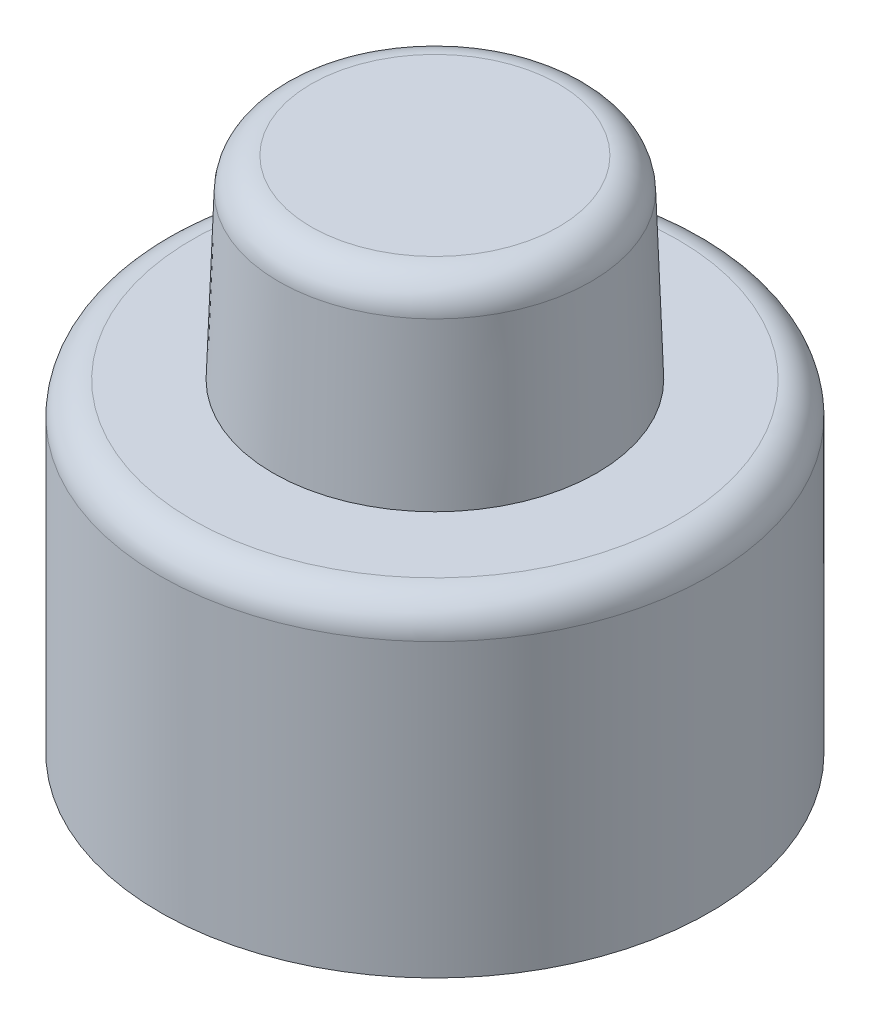
from build123d import *

# Parameters (mm, degrees)
SKETCH1_R           = 8.5
BOSS_EXTRUDE1_DEPTH = 6
FILLET2_R           = 1
SKETCH2_R           = 5
BOSS_EXTRUDE3_DEPTH = 6
BOSS_EXTRUDE3_TAPER = 2
FILLET4_R           = 1
BOSS_EXTRUDE4_START = 4
BOSS_EXTRUDE4_DEPTH = 4
CUT_EXTRUDE4_DEPTH  = 7
SKETCH7_W           = 5.003622488
SKETCH7_H           = 7
BOSS_EXTRUDE5_DEPTH = 8


with BuildPart() as part:
    # Sketch1 → Boss-Extrude1 (new body)
    with BuildSketch(Plane(origin=(0, 0, 0), x_dir=(1, 0, 0), z_dir=(0, 1, 0))):
        with Locations(Location((-51.120170416, 0, 0), (0, 0, 270))):
            Circle(SKETCH1_R)
    extrude(amount=BOSS_EXTRUDE1_DEPTH)

    # Fillet2
    fillet2_edges = [part.edges().sort_by_distance(p)[0] for p in [
        (-51.120170416, 6, -8.5),
    ]]
    fillet(fillet2_edges, radius=FILLET2_R)

    # Sketch2 → Boss-Extrude3 (add)
    with BuildSketch(Plane(origin=(0, 6, 0), x_dir=(1, 0, 0), z_dir=(0, 1, 0))):
        with Locations((-51.120170416, 0)):
            Circle(SKETCH2_R)
    extrude(amount=BOSS_EXTRUDE3_DEPTH, taper=BOSS_EXTRUDE3_TAPER)

    # Fillet4
    fillet4_edges = [part.edges().sort_by_distance(p)[0] for p in [
        (-55.9106458, 12, 0),
    ]]
    fillet(fillet4_edges, radius=FILLET4_R)

    # Sketch3 → Boss-Extrude4 (add)
    with BuildSketch(Plane.XZ.offset(BOSS_EXTRUDE4_START)):
        with BuildLine():
            Line((-51.620170416, 0), (-59.620170416, 0))
            ThreePointArc((-59.620170416, 0), (-57.304828855, -5.830951895), (-51.620170416, -8.485281374))
            Line((-51.620170416, -8.485281374), (-51.620170416, 0))
        make_face()
        with BuildLine():
            ThreePointArc((-42.620170416, 0), (-51.120170416, 8.5), (-59.620170416, 0))
            Line((-59.620170416, 0), (-51.620170416, 0))
            Line((-51.620170416, 0), (-51.620170416, 1.514718626))
            Line((-51.620170416, 1.514718626), (-46.616547928, 1.514718626))
            Line((-46.616547928, 1.514718626), (-46.616547928, 0))
            Line((-46.616547928, 0), (-42.620170416, 0))
        make_face()
        with BuildLine():
            ThreePointArc((-46.616547928, -7.208840717), (-43.686100497, -4.121238215), (-42.620170416, 0))
            Line((-42.620170416, 0), (-46.616547928, 0))
            Line((-46.616547928, 0), (-46.616547928, -7.208840717))
        make_face()
    extrude(amount=-BOSS_EXTRUDE4_DEPTH)

    # Sketch6 → Cut-Extrude4 (cut)
    with BuildSketch(Plane.XZ.offset(4)):
        with BuildLine():
            ThreePointArc((-46.616547928, -7.208840717), (-49.019081783, -8.236226475), (-51.620170416, -8.485281374))
            Line((-51.620170416, -8.485281374), (-51.620170416, 1.514718626))
            Line((-51.620170416, 1.514718626), (-46.616547928, 1.514718626))
            Line((-46.616547928, 1.514718626), (-46.616547928, -7.208840717))
        make_face()
    extrude(amount=-CUT_EXTRUDE4_DEPTH, mode=Mode.SUBTRACT)

    # Sketch7 → Boss-Extrude5 (add)
    with BuildSketch(Plane(origin=(0, 0, 1.514718626), x_dir=(-1, 0, 0), z_dir=(0, 0, -1))):
        with Locations((49.118359172, -0.5)):
            Rectangle(SKETCH7_W, SKETCH7_H)
    extrude(amount=BOSS_EXTRUDE5_DEPTH)


solid = part.part
